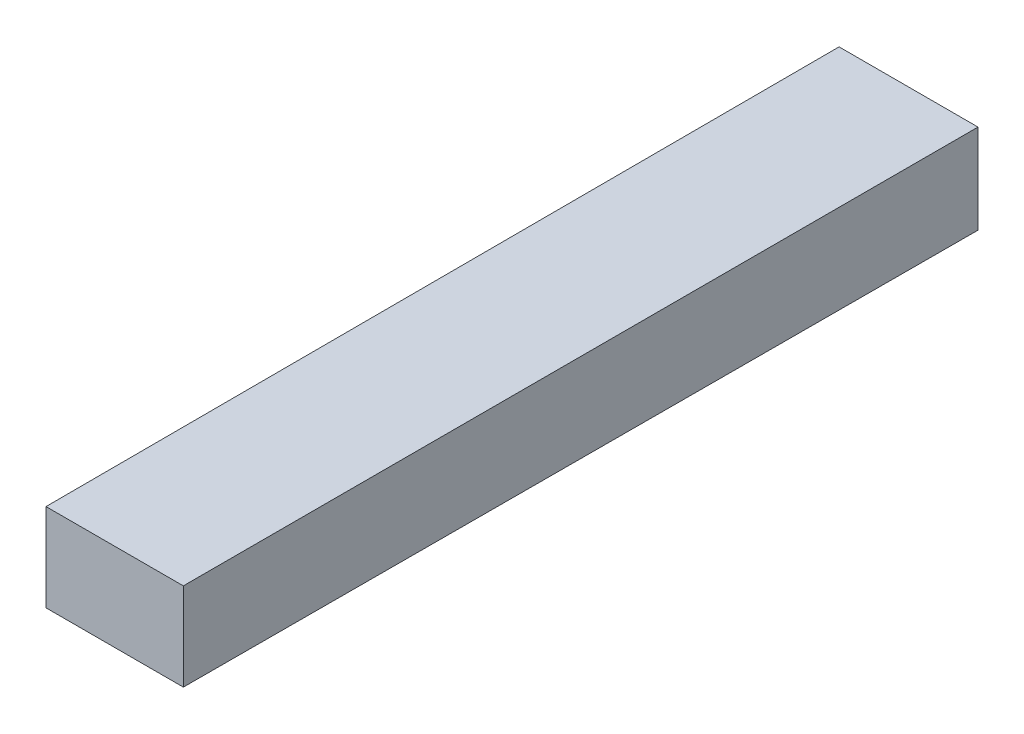
from build123d import *

# Parameters (mm, degrees)
SKETCH1_W           = 14
SKETCH1_H           = 9
BOSS_EXTRUDE1_DEPTH = 80
BOSS_EXTRUDE1_TAPER = 0.0573


with BuildPart() as part:
    # Sketch1 → Boss-Extrude1 (new body)
    with BuildSketch(Plane.XY):
        with Locations((-7, 4.5)):
            Rectangle(SKETCH1_W, SKETCH1_H)
    extrude(amount=BOSS_EXTRUDE1_DEPTH, taper=BOSS_EXTRUDE1_TAPER)


solid = part.part
